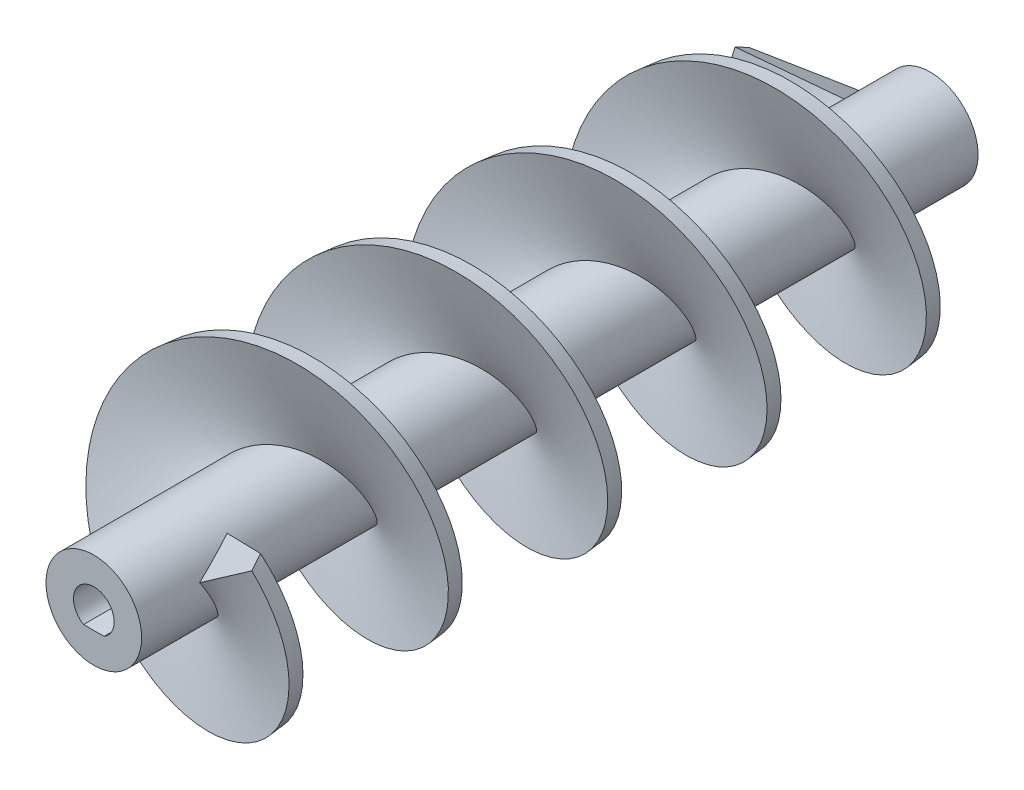
from build123d import *
from build123d.topology import SkipClean

# Parameters (mm, degrees)
SKETCH_1_R          = 6
EXTRUDE_1_DEPTH     = 105
SWEEP_1_PITCH       = 20
SWEEP_1_HEIGHT      = 92.5
SWEEP_1_RADIUS      = 6
SWEEP_1_START_ANGLE = 180


with BuildPart() as part:
    # Эскиз1 → Бобышка-Вытянуть1 (new body)
    with BuildSketch(Plane.XY):
        Circle(SKETCH_1_R)
        with BuildLine():
            Line((1.289379696, -2.2), (-1.289379696, -2.2))
            ThreePointArc((-1.289379696, -2.2), (0, 2.55), (1.289379696, -2.2))
        make_face(mode=Mode.SUBTRACT)
    extrude(amount=EXTRUDE_1_DEPTH)

    # По траектории1: sweep along a helix
    with SkipClean():  # the faces are left unmerged after this step: merging them gives an invalid solid
        with BuildLine() as sweep_1_path:
            add(Helix(SWEEP_1_PITCH, SWEEP_1_HEIGHT, SWEEP_1_RADIUS, center=(0, 0, 0), direction=(0, 0, 1), mode=Mode.PRIVATE).rotate(Axis((0, 0, 0), (0, 0, 1)), SWEEP_1_START_ANGLE))
        # Эскиз6 → По траектории1 (sweep)
        with BuildSketch(Plane(origin=(-6, 0, 0), x_dir=(1, 0, 0), z_dir=(0, 0.8833840459233997, -0.4686497918574221))):
            Polygon((-11, -6.5), (0, 0), (0.666275381, -5.493229004), (-11, -8.5), align=None)
        sweep(path=sweep_1_path.line, is_frenet=True)


solid = part.part
